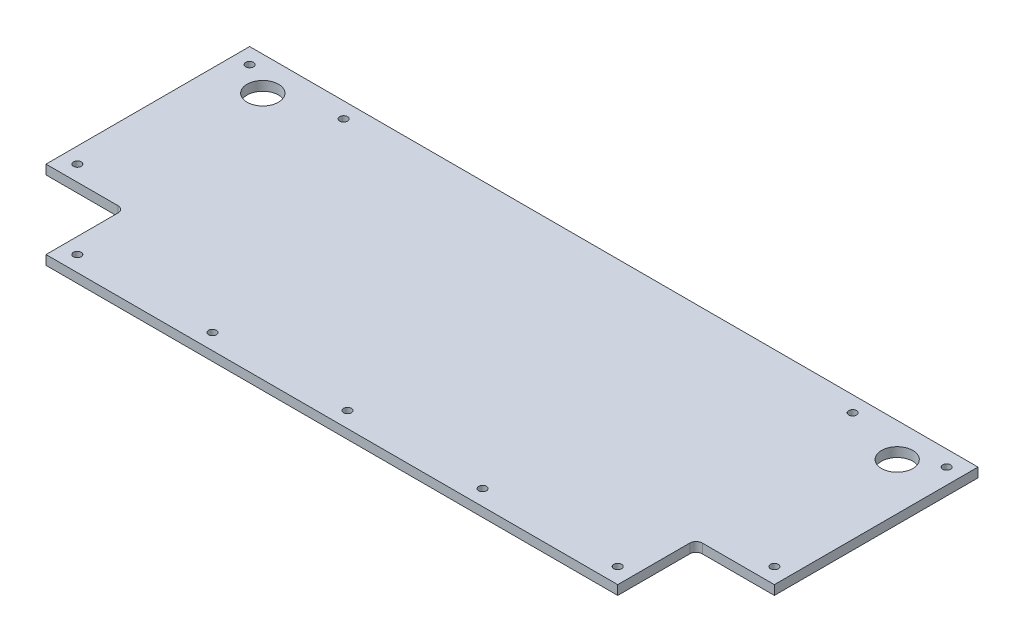
from build123d import *

# Parameters (mm, degrees)
BOSS_EXTRUDE1_DEPTH = 6
SKETCH2_R           = 2.5
CUT_EXTRUDE1_DEPTH  = 295.095647707
FILLET1_R           = 4
SKETCH3_R           = 10
CUT_EXTRUDE2_DEPTH  = 295.095647707


with BuildPart() as part:
    # Sketch1 → Boss-Extrude1 (new body)
    with BuildSketch(Plane(origin=(0, 0, 0), x_dir=(1, 0, 0), z_dir=(0, 1, 0))):
        Polygon((0, 0), (-182.5, 0), (-182.5, 50), (-232.5, 50), (-232.5, 180), (232.5, 180), (232.5, 50), (182.5, 50), (182.5, 0), align=None)
    extrude(amount=BOSS_EXTRUDE1_DEPTH)

    # Sketch2 → Cut-Extrude1 (cut, through all)
    with BuildSketch(Plane(origin=(0, 6, 0), x_dir=(1, 0, 0), z_dir=(0, 1, 0))):
        with Locations(Location((-222.5, 170, 0), (0, 0, 270))):
            Circle(SKETCH2_R)
        with Locations(Location((-222.5, 60, 0), (0, 0, 270))):
            Circle(SKETCH2_R)
        with Locations(Location((222.5, 170, 0), (0, 0, 270))):
            Circle(SKETCH2_R)
        with Locations(Location((222.5, 60, 0), (0, 0, 270))):
            Circle(SKETCH2_R)
        with Locations(Location((-172.5, 10, 0), (0, 0, 270))):
            Circle(SKETCH2_R)
        with Locations(Location((-86.25, 10, 0), (0, 0, 270))):
            Circle(SKETCH2_R)
        with Locations(Location((0, 10, 0), (0, 0, 270))):
            Circle(SKETCH2_R)
        with Locations(Location((86.25, 10, 0), (0, 0, 270))):
            Circle(SKETCH2_R)
        with Locations(Location((172.5, 10, 0), (0, 0, 270))):
            Circle(SKETCH2_R)
        with Locations(Location((-162.5, 170, 0), (0, 0, 270))):
            Circle(SKETCH2_R)
        with Locations(Location((162.5, 170, 0), (0, 0, 270))):
            Circle(SKETCH2_R)
    extrude(amount=-CUT_EXTRUDE1_DEPTH, mode=Mode.SUBTRACT)

    # Fillet1
    fillet1_edges = [part.edges().sort_by_distance(p)[0] for p in [
        (-182.5, 3, -50),
        (182.5, 3, -50),
    ]]
    fillet(fillet1_edges, radius=FILLET1_R)

    # Sketch3 → Cut-Extrude2 (cut, through all)
    with BuildSketch(Plane(origin=(0, 6, 0), x_dir=(1, 0, 0), z_dir=(0, 1, 0))):
        with Locations(Location((-202.5, 158.4, 0), (0, 0, 270))):
            Circle(SKETCH3_R)
        with Locations(Location((202.5, 158.4, 0), (0, 0, 270))):
            Circle(SKETCH3_R)
    extrude(amount=-CUT_EXTRUDE2_DEPTH, mode=Mode.SUBTRACT)


solid = part.part
